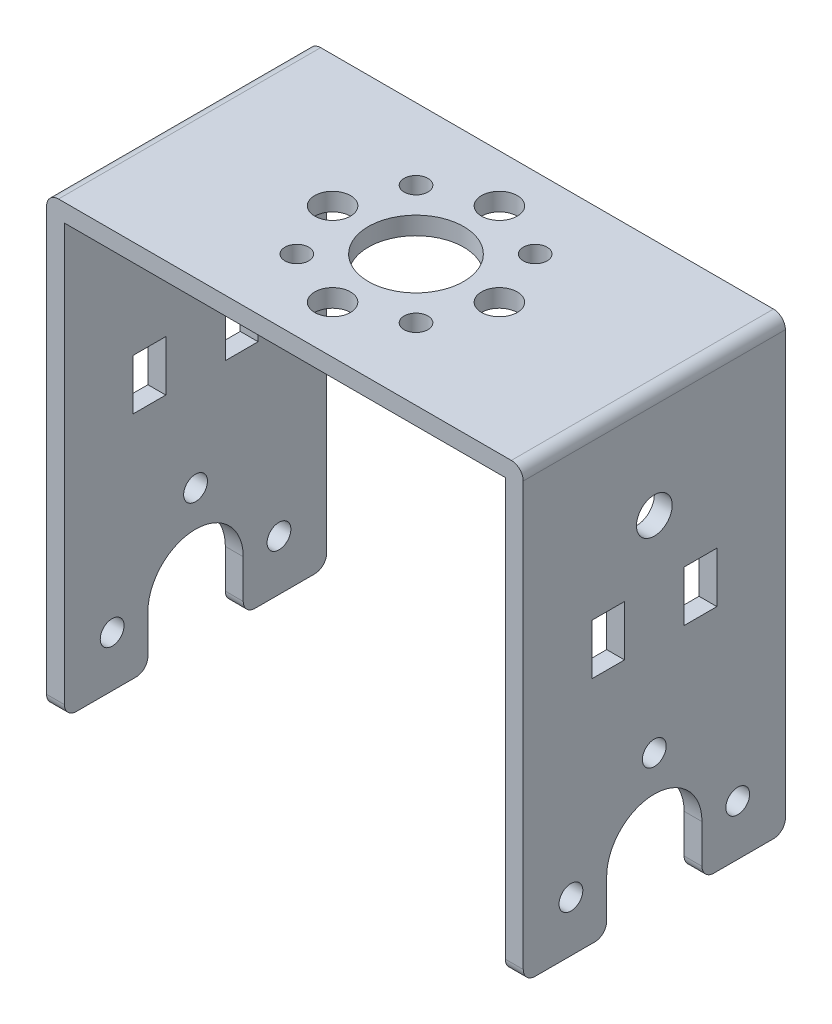
from build123d import *

# Parameters (mm, degrees)
SKETCH1_W           = 40
SKETCH1_H           = 22
SKETCH1_R           = 4
SKETCH1_R_2         = 1.5
SKETCH1_R_3         = 1
BOSS_EXTRUDE1_DEPTH = 1.5
SKETCH2_W           = 1.5
SKETCH2_H           = 22
BOSS_EXTRUDE2_DEPTH = 36
FILLET1_R           = 1
SKETCH3_R           = 1.5
SKETCH3_R_2         = 1
SKETCH3_W           = 2.75
SKETCH3_H           = 4.25
CUT_EXTRUDE1_DEPTH  = 55.927224579
FILLET2_R           = 1


with BuildPart() as part:
    # Sketch1 → Boss-Extrude1 (new body)
    with BuildSketch(Plane(origin=(0, 0, 0), x_dir=(1, 0, 0), z_dir=(0, 1, 0))):
        Rectangle(SKETCH1_W, SKETCH1_H)
        with Locations(Location((0, 0, 0), (0, 0, 270))):
            Circle(SKETCH1_R, mode=Mode.SUBTRACT)
        with Locations(Location((0, 7, 0), (0, 0, 270))):
            Circle(SKETCH1_R_2, mode=Mode.SUBTRACT)
        with Locations(Location((7, 0, 0), (0, 0, 270))):
            Circle(SKETCH1_R_2, mode=Mode.SUBTRACT)
        with Locations(Location((0, -7, 0), (0, 0, 270))):
            Circle(SKETCH1_R_2, mode=Mode.SUBTRACT)
        with Locations(Location((-7, 0, 0), (0, 0, 270))):
            Circle(SKETCH1_R_2, mode=Mode.SUBTRACT)
        with Locations(Location((5, 5, 0), (0, 0, 270))):
            Circle(SKETCH1_R_3, mode=Mode.SUBTRACT)
        with Locations(Location((5, -5, 0), (0, 0, 270))):
            Circle(SKETCH1_R_3, mode=Mode.SUBTRACT)
        with Locations(Location((-5, -5, 0), (0, 0, 270))):
            Circle(SKETCH1_R_3, mode=Mode.SUBTRACT)
        with Locations(Location((-5, 5, 0), (0, 0, 270))):
            Circle(SKETCH1_R_3, mode=Mode.SUBTRACT)
    extrude(amount=BOSS_EXTRUDE1_DEPTH)

    # Sketch2 → Boss-Extrude2 (add)
    with BuildSketch(Plane(origin=(0, 0, 0), x_dir=(-1, 0, 0), z_dir=(0, -1, 0))):
        with Locations((-19.25, 0)):
            Rectangle(SKETCH2_W, SKETCH2_H)
    boss_extrude2 = extrude(amount=BOSS_EXTRUDE2_DEPTH)

    # Mirror1: Boss-Extrude2 across plane
    add(boss_extrude2.mirror(Plane(origin=(0, 0, 0), x_dir=(0, 0, 1), z_dir=(1, 0, 0))))

    # Fillet1
    fillet1_edges = [part.edges().sort_by_distance(p)[0] for p in [
        (-20, 1.5, 0),
        (20, 1.5, 0),
    ]]
    fillet(fillet1_edges, radius=FILLET1_R)

    # Sketch3 → Cut-Extrude1 (cut, through all)
    with BuildSketch(Plane.ZY.offset(20)):
        with Locations((0, -7.5)):
            Circle(SKETCH3_R)
        with Locations((0, -24.75)):
            Circle(SKETCH3_R_2)
        with Locations((-7, -31.75)):
            Circle(SKETCH3_R_2)
        with Locations((7, -31.75)):
            Circle(SKETCH3_R_2)
        with BuildLine():
            Line((-4, -31.75), (-4, -36))
            Line((-4, -36), (4, -36))
            Line((4, -36), (4, -31.75))
            ThreePointArc((4, -31.75), (0, -27.75), (-4, -31.75))
        make_face()
        with Locations((-3.875, -14.625)):
            Rectangle(SKETCH3_W, SKETCH3_H)
        with Locations((3.875, -14.625)):
            Rectangle(SKETCH3_W, SKETCH3_H)
    extrude(amount=-CUT_EXTRUDE1_DEPTH, mode=Mode.SUBTRACT)

    # Fillet2
    fillet2_edges = [part.edges().sort_by_distance(p)[0] for p in [
        (19.25, -36, 4),
        (19.25, -36, -4),
        (19.25, -36, 11),
        (19.25, -36, -11),
        (-19.25, -36, -11),
        (-19.25, -36, 11),
        (-19.25, -36, -4),
        (-19.25, -36, 4),
    ]]
    fillet(fillet2_edges, radius=FILLET2_R)


solid = part.part
